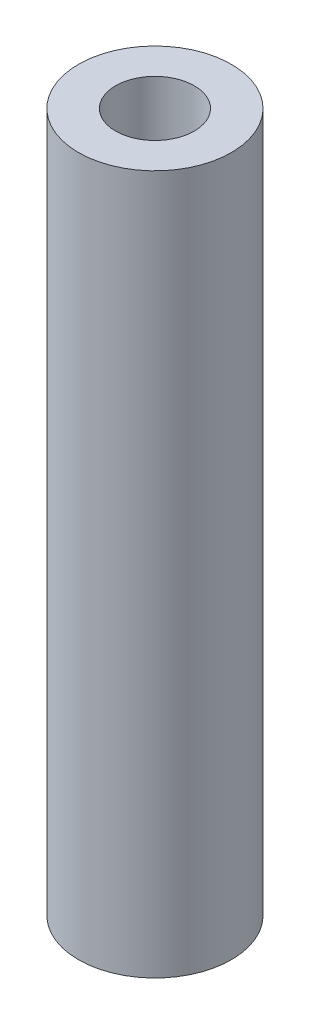
from build123d import *

# Parameters (mm, degrees)
SKETCH_1_R      = 1.75
SKETCH_1_R_2    = 0.9
EXTRUDE_1_DEPTH = 16


with BuildPart() as part:
    # 草图1 → 凸台-拉伸1 (new body)
    with BuildSketch(Plane(origin=(0, 0, 0), x_dir=(1, 0, 0), z_dir=(0, 1, 0))):
        with Locations(Location((0, 0, 0), (0, 0, 270))):
            Circle(SKETCH_1_R)
        with Locations(Location((0, 0, 0), (0, 0, 270))):
            Circle(SKETCH_1_R_2, mode=Mode.SUBTRACT)
    extrude(amount=EXTRUDE_1_DEPTH)


solid = part.part
